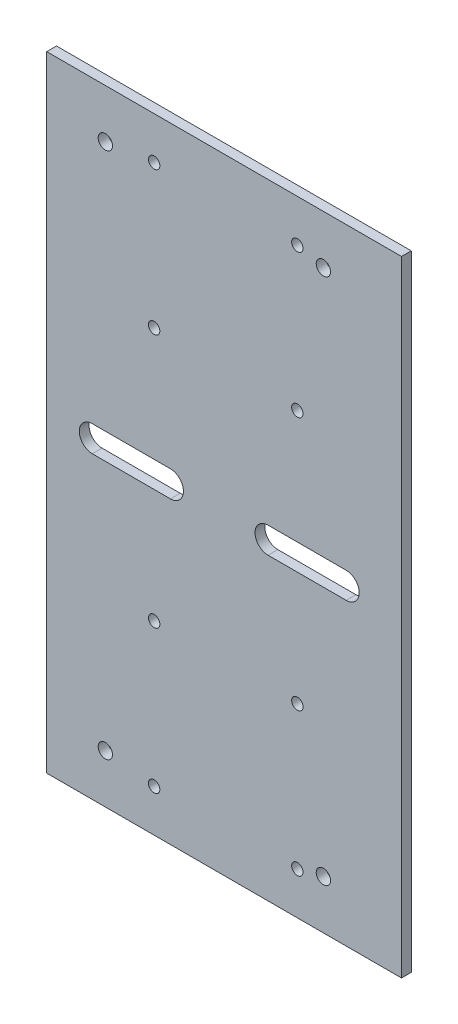
from build123d import *

# Parameters (mm, degrees)
WIRING_SLOTS_AND_DECK_MOUNTS_PROFILE_W   = 109
WIRING_SLOTS_AND_DECK_MOUNTS_PROFILE_H   = 192
WIRING_SLOTS_AND_DECK_MOUNTS_PROFILE_R   = 2.2
WIRING_SLOTS_AND_DECK_MOUNTS_PROFILE_R_2 = 1.75
WIRING_SLOTS_AND_DECK_MOUNTS_DEPTH       = 3


with BuildPart() as part:
    # Wiring slots and deck mounts profile → Wiring slots and deck mounts (new body)
    with BuildSketch(Plane.XY):
        with Locations((-0.5, 0)):
            Rectangle(WIRING_SLOTS_AND_DECK_MOUNTS_PROFILE_W, WIRING_SLOTS_AND_DECK_MOUNTS_PROFILE_H)
        with Locations((-37, -81)):
            Circle(WIRING_SLOTS_AND_DECK_MOUNTS_PROFILE_R, mode=Mode.SUBTRACT)
        with Locations((-37, 81)):
            Circle(WIRING_SLOTS_AND_DECK_MOUNTS_PROFILE_R, mode=Mode.SUBTRACT)
        with Locations((30, -81)):
            Circle(WIRING_SLOTS_AND_DECK_MOUNTS_PROFILE_R, mode=Mode.SUBTRACT)
        with Locations((30, 81)):
            Circle(WIRING_SLOTS_AND_DECK_MOUNTS_PROFILE_R, mode=Mode.SUBTRACT)
        with Locations((-22, -83)):
            Circle(WIRING_SLOTS_AND_DECK_MOUNTS_PROFILE_R_2, mode=Mode.SUBTRACT)
        with Locations((-22, 39)):
            Circle(WIRING_SLOTS_AND_DECK_MOUNTS_PROFILE_R_2, mode=Mode.SUBTRACT)
        with Locations((-22, -39)):
            Circle(WIRING_SLOTS_AND_DECK_MOUNTS_PROFILE_R_2, mode=Mode.SUBTRACT)
        with Locations((-22, 83)):
            Circle(WIRING_SLOTS_AND_DECK_MOUNTS_PROFILE_R_2, mode=Mode.SUBTRACT)
        with Locations((22, -83)):
            Circle(WIRING_SLOTS_AND_DECK_MOUNTS_PROFILE_R_2, mode=Mode.SUBTRACT)
        with Locations((22, 39)):
            Circle(WIRING_SLOTS_AND_DECK_MOUNTS_PROFILE_R_2, mode=Mode.SUBTRACT)
        with Locations((22, -39)):
            Circle(WIRING_SLOTS_AND_DECK_MOUNTS_PROFILE_R_2, mode=Mode.SUBTRACT)
        with Locations((22, 83)):
            Circle(WIRING_SLOTS_AND_DECK_MOUNTS_PROFILE_R_2, mode=Mode.SUBTRACT)
        with BuildLine():
            Line((-41, -4), (-17, -4))
            ThreePointArc((-17, -4), (-13, 0), (-17, 4))
            Line((-17, 4), (-41, 4))
            ThreePointArc((-41, 4), (-45, 0), (-41, -4))
        make_face(mode=Mode.SUBTRACT)
        with BuildLine():
            Line((13, -4), (37, -4))
            ThreePointArc((37, -4), (41, 0), (37, 4))
            Line((37, 4), (13, 4))
            ThreePointArc((13, 4), (9, 0), (13, -4))
        make_face(mode=Mode.SUBTRACT)
    extrude(amount=WIRING_SLOTS_AND_DECK_MOUNTS_DEPTH)


solid = part.part
